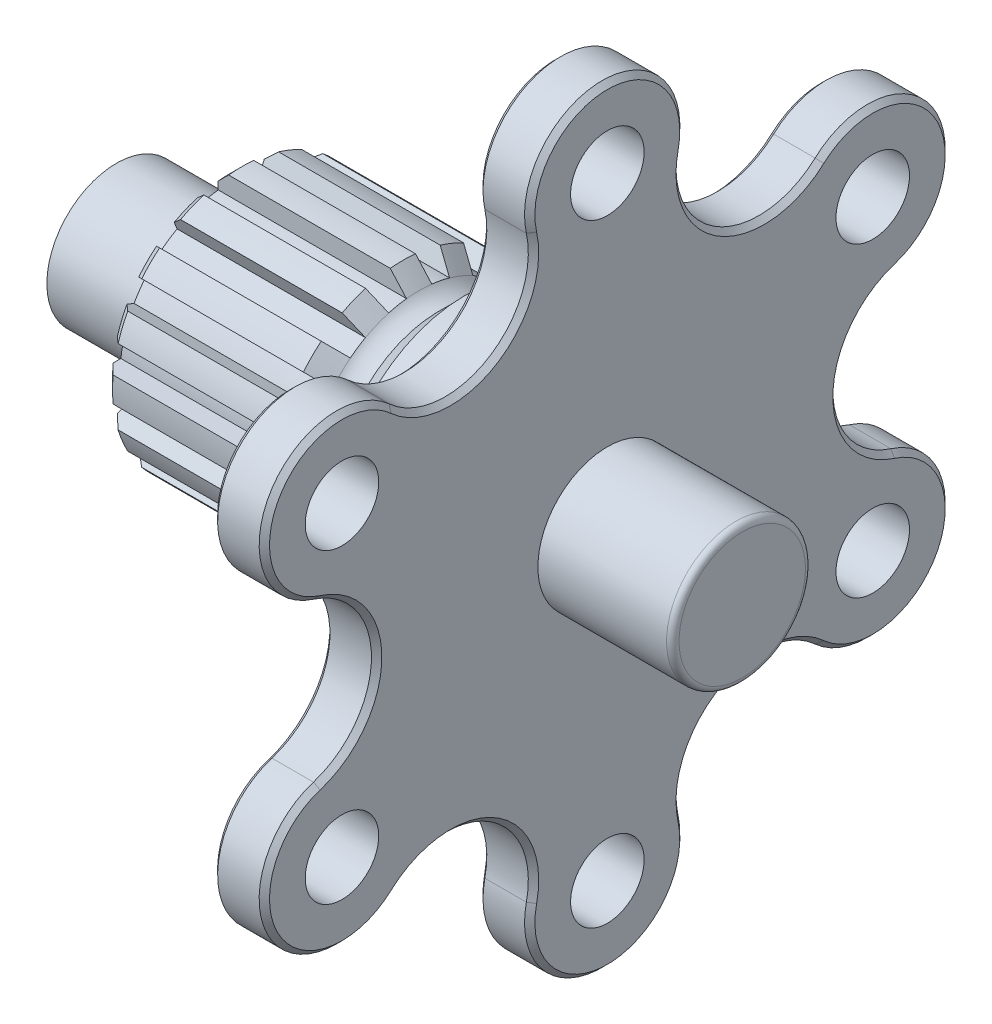
from build123d import *

# Parameters (mm, degrees)
SKETCH1_R              = 47
BASE_EXTRUDE_DEPTH     = 6.35
M8_CLEARANCE_HOLES_D   = 9
CIRPATTERN_COUNT       = 6
CUT_EXTRUDE_DEPTH      = 67.770670957
CUT_EXTRUDE_DEPTH_BACK = 67.770670957
CHAMFER1_SIZE          = 0.635
SKETCH8_R              = 15.748
SHAFT_EXTRUDE_DEPTH    = 52.5820005
CHAMFER3_SIZE          = 0.635
SHAFT_CHAMFER_SIZE     = 1
CUT_EXTRUDE1_START     = -12.856999432
SKETCH45_R             = 15.748
SKETCH45_R_2           = 8.5127
CUT_EXTRUDE1_DEPTH     = 12.856999432
SKETCH55_R             = 8.5
BOSS_EXTRUDE4_DEPTH    = 16.51
SKETCH56_R             = 8.5127
BOSS_EXTRUDE5_DEPTH    = 1.143
FILLET9_R              = 1.524
FILLET12_R             = 3.175
CUT_EXTRUDE20_START    = -25.4
CUT_EXTRUDE20_DEPTH    = 25.4
CHAMFER7_SIZE          = 1.27
FILLET14_R             = 0.762


with BuildPart() as part:
    # Sketch1 → Base-Extrude (new body)
    with BuildSketch(Plane(origin=(0, 0, 0), x_dir=(0, 0, -1), z_dir=(1, 0, 0))):
        Circle(SKETCH1_R)
    extrude(amount=-BASE_EXTRUDE_DEPTH)

    # M8 Clearance Holes (through all)
    with Locations(Plane(origin=(0, 0, 0), x_dir=(0, 0, -1), z_dir=(1, 0, 0))):
        with Locations((0, -37.5)):
            m8_clearance_holes = Hole(M8_CLEARANCE_HOLES_D / 2)

    # CirPattern: M8 Clearance Holes ×6 about axis
    cirpattern_axis = Axis((-6.35, 0, 0), (1, 0, 0))
    for i in range(1, CIRPATTERN_COUNT):
        add(m8_clearance_holes.rotate(cirpattern_axis, i * 360 / CIRPATTERN_COUNT), mode=Mode.SUBTRACT)

    # Sketch19 → Cut-Extrude (cut, two sides: drawn at the far end of the back side and taken through both)
    with BuildSketch(Plane(origin=(0, 0, 0), x_dir=(0, 0, -1), z_dir=(1, 0, 0)).offset(-CUT_EXTRUDE_DEPTH_BACK)):
        with BuildLine():
            ThreePointArc((9.274838239, 35.443941724), (14.114033661, 24.446223401), (26.057934823, 25.754216393))
            ThreePointArc((26.057934823, 25.754216393), (33.921184851, 28.139425108), (40.703194264, 23.499999504))
            ThreePointArc((40.703194264, 23.499999504), (23.500000227, 40.703193847), (-4.7e-08, 47))
            ThreePointArc((-4.7e-08, 47), (7.40886473, 43.446320157), (9.274838239, 35.443941724))
        make_face()
        with BuildLine():
            ThreePointArc((-26.057934823, 25.754216393), (-14.114033661, 24.446223401), (-9.274838239, 35.443941724))
            ThreePointArc((-9.274838239, 35.443941724), (-7.40886476, 43.44632012), (-4.7e-08, 47))
            ThreePointArc((-4.7e-08, 47), (-23.500000787, 40.703193523), (-40.703194863, 23.499998466))
            ThreePointArc((-40.703194863, 23.499998466), (-33.921185443, 28.139425017), (-26.057934823, 25.754216393))
        make_face()
        with BuildLine():
            ThreePointArc((40.703193464, -23.50000089), (47, -8e-07), (40.703194264, 23.499999504))
            ThreePointArc((40.703194264, 23.499999504), (41.33004921, 15.30689472), (35.332773062, 9.689725331))
            ThreePointArc((35.332773062, 9.689725331), (28.228067323, 0), (35.332773062, -9.689725331))
            ThreePointArc((35.332773062, -9.689725331), (41.330049499, -15.306895465), (40.703193464, -23.50000089))
        make_face()
        with BuildLine():
            ThreePointArc((-35.332773062, 9.689725331), (-41.330048992, 15.306894161), (-40.703194863, 23.499998466))
            ThreePointArc((-40.703194863, 23.499998466), (-47, -6.9e-08), (-40.703194794, -23.499998586))
            ThreePointArc((-40.703194794, -23.499998586), (-41.330049018, -15.306894226), (-35.332773062, -9.689725331))
            ThreePointArc((-35.332773062, -9.689725331), (-28.228067323, 0), (-35.332773062, 9.689725331))
        make_face()
        with BuildLine():
            ThreePointArc((-26.057934823, -25.754216393), (-33.921185375, -28.139425028), (-40.703194794, -23.499998586))
            ThreePointArc((-40.703194794, -23.499998586), (-23.500000688, -40.703193581), (4.4e-08, -47))
            ThreePointArc((4.4e-08, -47), (-7.408864732, -43.446320155), (-9.274838239, -35.443941724))
            ThreePointArc((-9.274838239, -35.443941724), (-14.114033661, -24.446223401), (-26.057934823, -25.754216393))
        make_face()
        with BuildLine():
            ThreePointArc((4.4e-08, -47), (23.499999574, -40.703194224), (40.703193464, -23.50000089))
            ThreePointArc((40.703193464, -23.50000089), (33.92118406, -28.13942523), (26.057934823, -25.754216393))
            ThreePointArc((26.057934823, -25.754216393), (14.114033661, -24.446223401), (9.274838239, -35.443941724))
            ThreePointArc((9.274838239, -35.443941724), (7.408864759, -43.446320121), (4.4e-08, -47))
        make_face()
    extrude(amount=CUT_EXTRUDE_DEPTH + CUT_EXTRUDE_DEPTH_BACK, mode=Mode.SUBTRACT)

    # Chamfer1
    chamfer1_edges = [part.edges().sort_by_distance(p)[0] for p in [
        (-6.35, 0, 28.228067323),
        (-6.35, -23.5, 40.703193978),
        (-6.35, 23.5, 40.703193978),
        (-6.35, -24.446223401, 14.114033661),
        (-6.35, 24.446223401, 14.114033661),
        (-6.35, -47, 0),
        (-6.35, 47, 0),
        (-6.35, -24.446223401, -14.114033661),
        (-6.35, -23.5, -40.703193978),
        (-6.35, 0, -28.228067323),
        (-6.35, 23.5, -40.703193978),
        (-6.35, 24.446223401, -14.114033661),
    ]]
    chamfer(chamfer1_edges, length=CHAMFER1_SIZE)

    # Sketch8 → Shaft-Extrude (add)
    with BuildSketch(Plane.ZY.offset(6.35)):
        Circle(SKETCH8_R)
    extrude(amount=SHAFT_EXTRUDE_DEPTH)

    # Chamfer3
    chamfer3_edges = [part.edges().sort_by_distance(p)[0] for p in [
        (0, -23.5, 40.703193978),
        (0, 0, 28.228067323),
        (0, -24.446223401, 14.114033661),
        (0, 23.5, 40.703193978),
        (0, -47, 0),
        (0, 24.446223401, 14.114033661),
        (0, -24.446223401, -14.114033661),
        (0, 47, 0),
        (0, 24.446223401, -14.114033661),
        (0, -23.5, -40.703193978),
        (0, 0, -28.228067323),
        (0, 23.5, -40.703193978),
    ]]
    chamfer(chamfer3_edges, length=CHAMFER3_SIZE)

    # Shaft Chamfer
    shaft_chamfer_edges = [part.edges().sort_by_distance(p)[0] for p in [
        (-58.9320005, 0, -15.748),
    ]]
    chamfer(shaft_chamfer_edges, length=SHAFT_CHAMFER_SIZE)

    # Sketch45 → Cut-Extrude1 (cut)
    with BuildSketch(Plane.ZY.offset(58.9320005).offset(CUT_EXTRUDE1_START)):
        Circle(SKETCH45_R)
        Circle(SKETCH45_R_2, mode=Mode.SUBTRACT)
    extrude(amount=CUT_EXTRUDE1_DEPTH, mode=Mode.SUBTRACT)

    # Sketch55 → Boss-Extrude4 (add)
    with BuildSketch(Plane(origin=(0, 0, 0), x_dir=(0, 0, -1), z_dir=(1, 0, 0))):
        Circle(SKETCH55_R)
    extrude(amount=BOSS_EXTRUDE4_DEPTH)

    # Sketch56 → Boss-Extrude5 (add)
    with BuildSketch(Plane.ZY.offset(58.9320005)):
        Circle(SKETCH56_R)
    extrude(amount=BOSS_EXTRUDE5_DEPTH)

    # Fillet9
    fillet9_edges = [part.edges().sort_by_distance(p)[0] for p in [
        (-46.075001068, 0, -8.5127),
    ]]
    fillet(fillet9_edges, radius=FILLET9_R)

    # Fillet12
    fillet12_edges = [part.edges().sort_by_distance(p)[0] for p in [
        (-6.35, 0, -15.748),
    ]]
    fillet(fillet12_edges, radius=FILLET12_R)

    # Sketch102 → Cut-Extrude20 (cut)
    with BuildSketch(Plane.ZY.offset(46.075001068).offset(CUT_EXTRUDE20_START)):
        with BuildLine():
            Line((-1.543304, 13.455060235), (-1.543304, 15.672195659))
            ThreePointArc((-1.543304, 15.672195659), (-3.072282391, 15.445406596), (-4.571662649, 15.06981767))
            Line((-4.571662649, 15.06981767), (-3.723201655, 13.021451632))
            ThreePointArc((-3.723201655, 13.021451632), (-2.642162856, 13.283049672), (-1.543304, 13.455060235))
        make_face()
        with BuildLine():
            ThreePointArc((4.571662649, 15.06981767), (3.072282391, 15.445406596), (1.543304, 15.672195659))
            Line((1.543304, 15.672195659), (1.543304, 13.455060235))
            ThreePointArc((1.543304, 13.455060235), (2.642162856, 13.283049672), (3.723201655, 13.021451632))
            Line((3.723201655, 13.021451632), (4.571662649, 15.06981767))
        make_face()
        with BuildLine():
            Line((-6.574855611, 11.840257888), (-7.423316605, 13.888623927))
            ThreePointArc((-7.423316605, 13.888623927), (-8.74912003, 13.093983455), (-9.990635102, 12.17319655))
            Line((-9.990635102, 12.17319655), (-8.422883609, 10.605445057))
            ThreePointArc((-8.422883609, 10.605445057), (-7.524243225, 11.260825771), (-6.574855611, 11.840257888))
        make_face()
        with BuildLine():
            ThreePointArc((9.990635102, 12.17319655), (8.74912003, 13.093983455), (7.423316605, 13.888623927))
            Line((7.423316605, 13.888623927), (6.574855611, 11.840257888))
            ThreePointArc((6.574855611, 11.840257888), (7.524243225, 11.260825771), (8.422883609, 10.605445057))
            Line((8.422883609, 10.605445057), (9.990635102, 12.17319655))
        make_face()
        with BuildLine():
            Line((-10.605445057, 8.422883609), (-12.17319655, 9.990635102))
            ThreePointArc((-12.17319655, 9.990635102), (-13.093983455, 8.74912003), (-13.888623927, 7.423316605))
            Line((-13.888623927, 7.423316605), (-11.840257888, 6.574855611))
            ThreePointArc((-11.840257888, 6.574855611), (-11.260825771, 7.524243225), (-10.605445057, 8.422883609))
        make_face()
        with BuildLine():
            ThreePointArc((13.888623927, 7.423316605), (13.093983455, 8.74912003), (12.17319655, 9.990635102))
            Line((12.17319655, 9.990635102), (10.605445057, 8.422883609))
            ThreePointArc((10.605445057, 8.422883609), (11.260825771, 7.524243225), (11.840257888, 6.574855611))
            Line((11.840257888, 6.574855611), (13.888623927, 7.423316605))
        make_face()
        with BuildLine():
            Line((-13.021451632, 3.723201655), (-15.06981767, 4.571662649))
            ThreePointArc((-15.06981767, 4.571662649), (-15.445406596, 3.072282391), (-15.672195659, 1.543304))
            Line((-15.672195659, 1.543304), (-13.455060235, 1.543304))
            ThreePointArc((-13.455060235, 1.543304), (-13.283049672, 2.642162856), (-13.021451632, 3.723201655))
        make_face()
        with BuildLine():
            ThreePointArc((15.672195659, 1.543304), (15.445406596, 3.072282391), (15.06981767, 4.571662649))
            Line((15.06981767, 4.571662649), (13.021451632, 3.723201655))
            ThreePointArc((13.021451632, 3.723201655), (13.283049672, 2.642162856), (13.455060235, 1.543304))
            Line((13.455060235, 1.543304), (15.672195659, 1.543304))
        make_face()
        with BuildLine():
            Line((-13.455060235, -1.543304), (-15.672195659, -1.543304))
            ThreePointArc((-15.672195659, -1.543304), (-15.445406596, -3.072282391), (-15.06981767, -4.571662649))
            Line((-15.06981767, -4.571662649), (-13.021451632, -3.723201655))
            ThreePointArc((-13.021451632, -3.723201655), (-13.283049672, -2.642162856), (-13.455060235, -1.543304))
        make_face()
        with BuildLine():
            ThreePointArc((15.06981767, -4.571662649), (15.445406596, -3.072282391), (15.672195659, -1.543304))
            Line((15.672195659, -1.543304), (13.455060235, -1.543304))
            ThreePointArc((13.455060235, -1.543304), (13.283049672, -2.642162856), (13.021451632, -3.723201655))
            Line((13.021451632, -3.723201655), (15.06981767, -4.571662649))
        make_face()
        with BuildLine():
            Line((-11.840257888, -6.574855611), (-13.888623927, -7.423316605))
            ThreePointArc((-13.888623927, -7.423316605), (-13.093983455, -8.74912003), (-12.17319655, -9.990635102))
            Line((-12.17319655, -9.990635102), (-10.605445057, -8.422883609))
            ThreePointArc((-10.605445057, -8.422883609), (-11.260825771, -7.524243225), (-11.840257888, -6.574855611))
        make_face()
        with BuildLine():
            ThreePointArc((12.17319655, -9.990635102), (13.093983455, -8.74912003), (13.888623927, -7.423316605))
            Line((13.888623927, -7.423316605), (11.840257888, -6.574855611))
            ThreePointArc((11.840257888, -6.574855611), (11.260825771, -7.524243225), (10.605445057, -8.422883609))
            Line((10.605445057, -8.422883609), (12.17319655, -9.990635102))
        make_face()
        with BuildLine():
            Line((-8.422883609, -10.605445057), (-9.990635102, -12.17319655))
            ThreePointArc((-9.990635102, -12.17319655), (-8.74912003, -13.093983455), (-7.423316605, -13.888623927))
            Line((-7.423316605, -13.888623927), (-6.574855611, -11.840257888))
            ThreePointArc((-6.574855611, -11.840257888), (-7.524243225, -11.260825771), (-8.422883609, -10.605445057))
        make_face()
        with BuildLine():
            ThreePointArc((7.423316605, -13.888623927), (8.74912003, -13.093983455), (9.990635102, -12.17319655))
            Line((9.990635102, -12.17319655), (8.422883609, -10.605445057))
            ThreePointArc((8.422883609, -10.605445057), (7.524243225, -11.260825771), (6.574855611, -11.840257888))
            Line((6.574855611, -11.840257888), (7.423316605, -13.888623927))
        make_face()
        with BuildLine():
            Line((-3.723201655, -13.021451632), (-4.571662649, -15.06981767))
            ThreePointArc((-4.571662649, -15.06981767), (-3.072282391, -15.445406596), (-1.543304, -15.672195659))
            Line((-1.543304, -15.672195659), (-1.543304, -13.455060235))
            ThreePointArc((-1.543304, -13.455060235), (-2.642162856, -13.283049672), (-3.723201655, -13.021451632))
        make_face()
        with BuildLine():
            ThreePointArc((1.543304, -15.672195659), (3.072282391, -15.445406596), (4.571662649, -15.06981767))
            Line((4.571662649, -15.06981767), (3.723201655, -13.021451632))
            ThreePointArc((3.723201655, -13.021451632), (2.642162856, -13.283049672), (1.543304, -13.455060235))
            Line((1.543304, -13.455060235), (1.543304, -15.672195659))
        make_face()
    extrude(amount=CUT_EXTRUDE20_DEPTH, mode=Mode.SUBTRACT)

    # Sketch104 → Cut-Revolve3 (revolve, cut)
    with BuildSketch(Plane.XY):
        with BuildLine():
            Line((-20.675001068, 12.497195659), (-17.500001068, 15.672195659))
            Line((-17.500001068, 15.672195659), (-17.500001068, 16.432455683))
            Line((-17.500001068, 16.432455683), (-23.850001068, 16.432455683))
            Line((-23.850001068, 16.432455683), (-25.56386945, 16.3462787))
            Line((-25.56386945, 16.3462787), (-23.030493186, 13.54328))
            ThreePointArc((-23.030493186, 13.54328), (-21.963666615, 12.770477873), (-20.675001068, 12.497195659))
        make_face()
    revolve(axis=Axis((-47.599001068, 0, 0), (-1, 0, 0)), mode=Mode.SUBTRACT)

    # Chamfer7
    chamfer7_edges = [part.edges().sort_by_distance(p)[0] for p in [
        (-46.075001068, -15.748, 0),
        (-46.075001068, -14.549254878, -6.026498693),
        (-46.075001068, -11.13551759, -11.13551759),
        (-46.075001068, -6.026498693, -14.549254878),
        (-46.075001068, 0, -15.748),
        (-46.075001068, 6.026498693, -14.549254878),
        (-46.075001068, 11.13551759, -11.13551759),
        (-46.075001068, 14.549254878, -6.026498693),
        (-46.075001068, 15.748, 0),
        (-46.075001068, -14.549254878, 6.026498693),
        (-46.075001068, -11.13551759, 11.13551759),
        (-46.075001068, -6.026498693, 14.549254878),
        (-46.075001068, 0, 15.748),
        (-46.075001068, 6.026498693, 14.549254878),
        (-46.075001068, 11.13551759, 11.13551759),
        (-46.075001068, 14.549254878, 6.026498693),
    ]]
    chamfer(chamfer7_edges, length=CHAMFER7_SIZE)

    # Fillet14
    fillet14_edges = [part.edges().sort_by_distance(p)[0] for p in [
        (16.51, 0, 8.5),
    ]]
    fillet(fillet14_edges, radius=FILLET14_R)


solid = part.part
